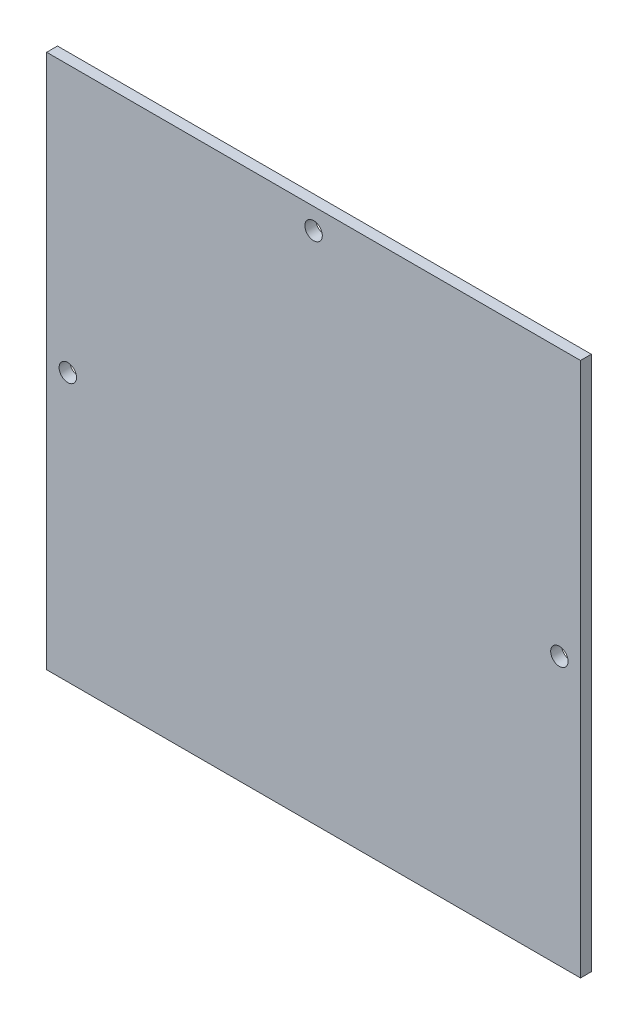
from build123d import *

# Parameters (mm, degrees)
SKETCH1_W                  = 88.865
SKETCH1_H                  = 89.025
BOSS_EXTRUDE1_DEPTH        = 1.8
M2_5_CLEARANCE_HOLE1_D     = 2.9
M2_5_CLEARANCE_HOLE1_DEPTH = 4
M2_5_CLEARANCE_HOLE1_TIP   = 0.871247898


with BuildPart() as part:
    # Sketch1 → Boss-Extrude1 (new body)
    with BuildSketch(Plane.XY):
        with Locations((44.4325, 44.5125)):
            Rectangle(SKETCH1_W, SKETCH1_H)
    extrude(amount=BOSS_EXTRUDE1_DEPTH)

    # M2.5 Clearance Hole1
    with Locations(Plane.XY.offset(1.8)):
        with Locations((44.4325, 85.525), (3.52, 44.6125), (85.345, 44.6125)):
            Hole(M2_5_CLEARANCE_HOLE1_D / 2, depth=M2_5_CLEARANCE_HOLE1_DEPTH)
            with Locations((0, 0, -(M2_5_CLEARANCE_HOLE1_DEPTH + M2_5_CLEARANCE_HOLE1_TIP / 2))):  # 118° drill point
                Cone(0, M2_5_CLEARANCE_HOLE1_D / 2, M2_5_CLEARANCE_HOLE1_TIP, mode=Mode.SUBTRACT)


solid = part.part
